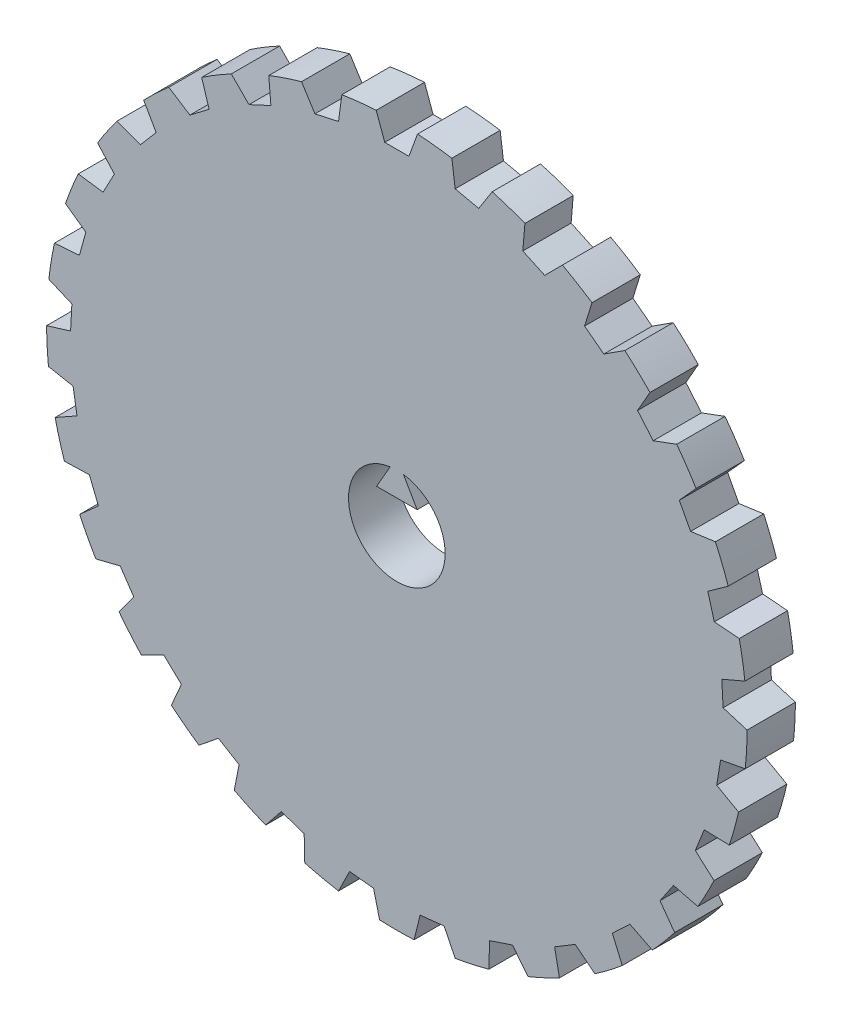
from build123d import *

# Parameters (mm, degrees)
SKETCH1_R           = 3.625
BOSS_EXTRUDE2_DEPTH = 0.5
CUT_EXTRUDE1_DEPTH  = 6.150849445
CIRPATTERN1_COUNT   = 29


with BuildPart() as part:
    # Sketch1 → Boss-Extrude2 (new body)
    with BuildSketch(Plane.XY):
        Circle(SKETCH1_R)
        with BuildLine():
            Line((-0.21, 0.25), (0, 0.25))
            Line((0, 0.25), (0.21, 0.25))
            Line((0.21, 0.25), (0.06837431, 0.495302891))
            ThreePointArc((0.06837431, 0.495302891), (0, -0.5), (-0.06837431, 0.495302891))
            Line((-0.06837431, 0.495302891), (-0.21, 0.25))
        make_face(mode=Mode.SUBTRACT)
    extrude(amount=BOSS_EXTRUDE2_DEPTH)

    # Sketch1<3> → Cut-Extrude1 (cut, symmetric)
    with BuildSketch(Plane.XY):
        with BuildLine():
            Line((-0.125, 3.375), (0.125, 3.375))
            Line((0.125, 3.375), (0.213697962, 3.618695646))
            ThreePointArc((0.213697962, 3.618695646), (0, 3.625), (-0.213697962, 3.618695646))
            Line((-0.213697962, 3.618695646), (-0.125, 3.375))
        make_face()
    cut_extrude1 = extrude(amount=CUT_EXTRUDE1_DEPTH, both=True, mode=Mode.SUBTRACT)

    # CirPattern1: Cut-Extrude1 ×29 about axis
    cirpattern1_axis = Axis((0, 0, 0.5), (0, 0, -1))
    for i in range(1, CIRPATTERN1_COUNT):
        add(cut_extrude1.rotate(cirpattern1_axis, i * 360 / CIRPATTERN1_COUNT), mode=Mode.SUBTRACT)


solid = part.part
